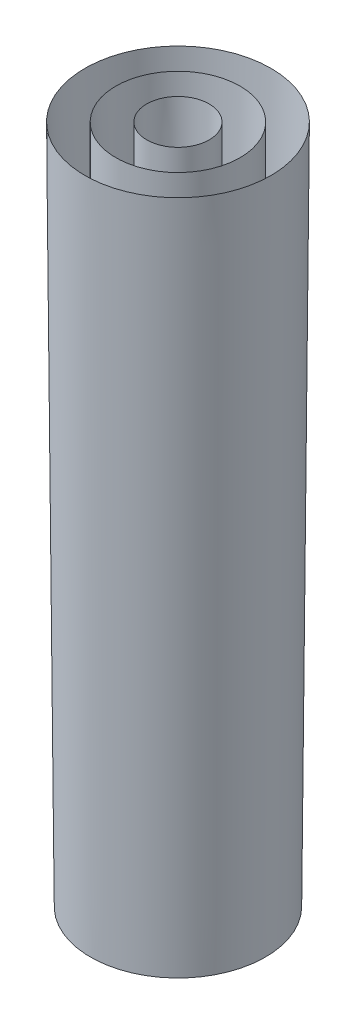
from build123d import *


with BuildPart() as part:
    # Эскиз1 → Повернуть1 (revolve)
    with BuildSketch(Plane.XY, mode=Mode.PRIVATE) as revolve_1_sk:
        Polygon((-2.624106939, 0), (3.965723428, 145), (3.965723428, 0), (10.555553795, 145), (10.555553795, 0), (17.145384162, 145), (15.979467058, 0), (15.311838216, 0), (15.852343113, 110.47254002), (11.684286956, 13.963376462), (11.009546945, -0.425210076), (10.186932252, -0.425210076), (9.467789771, 109.948786309), (4.600142305, 6.147965775), (4.294062463, -0.379076085), (3.524786138, -0.379076085), (3.220264843, 109.948786309), (-1.935686028, 0), align=None)
    revolve(revolve_1_sk.sketch.rotate(Axis((-2.687740891, -0.11397744, 0), (0, 1, 0)), 90), axis=Axis((-2.687740891, -0.11397744, 0), (0, 1, 0)))


solid = part.part
